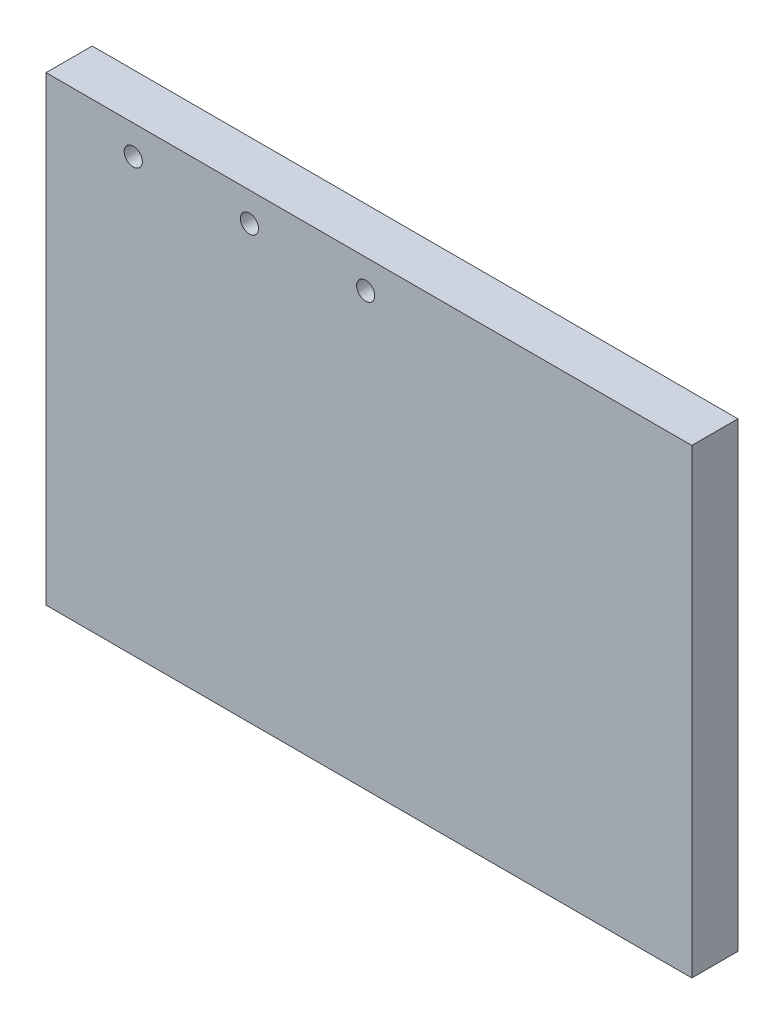
from build123d import *

# Parameters (mm, degrees)
SKETCH1_W           = 88.9
SKETCH1_H           = 63.5
BOSS_EXTRUDE1_DEPTH = 6.35
SKETCH2_R           = 1.25
CUT_EXTRUDE1_DEPTH  = 55.99261314


with BuildPart() as part:
    # Sketch1 → Boss-Extrude1 (new body)
    with BuildSketch(Plane.XY):
        Rectangle(SKETCH1_W, SKETCH1_H)
    extrude(amount=BOSS_EXTRUDE1_DEPTH)

    # Sketch2 → Cut-Extrude1 (cut, through all)
    with BuildSketch(Plane(origin=(0, 0, 0), x_dir=(-1, 0, 0), z_dir=(0, 0, -1))):
        with Locations((0.45, 27.749999872)):
            Circle(SKETCH2_R)
        with Locations((32.45, 27.749999872)):
            Circle(SKETCH2_R)
        with Locations((16.45, 27.749999872)):
            Circle(SKETCH2_R)
    extrude(amount=-CUT_EXTRUDE1_DEPTH, mode=Mode.SUBTRACT)


solid = part.part
